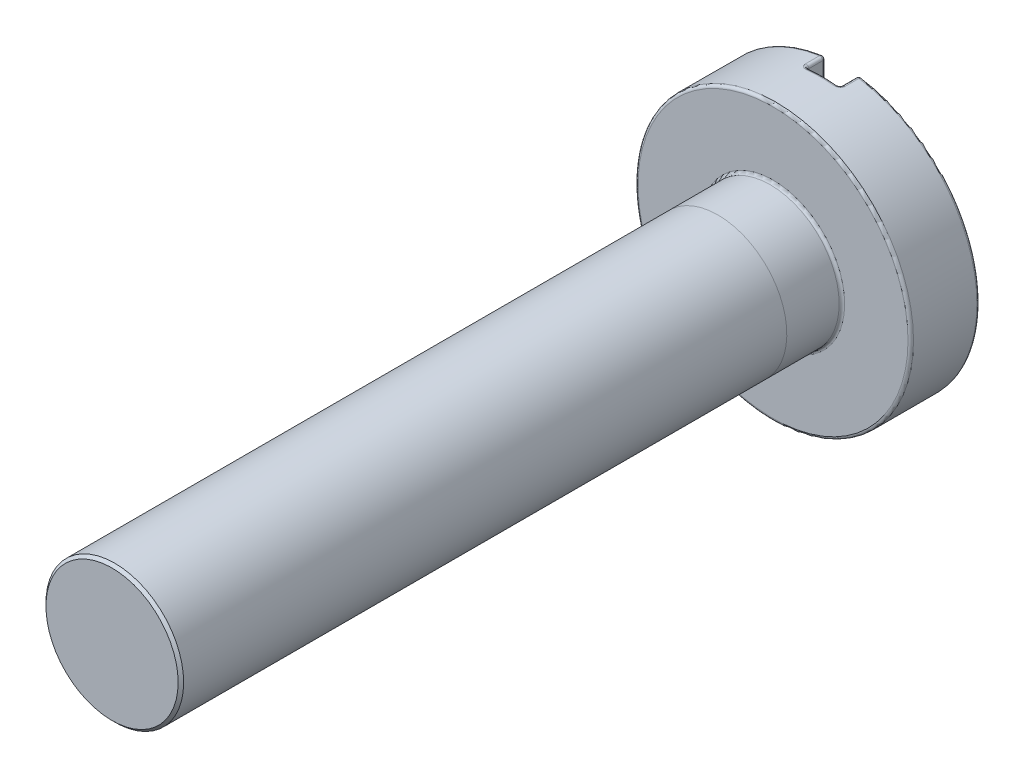
from build123d import *

# Parameters (mm, degrees)
SKETCH1_R           = 1.25
BOSS_EXTRUDE1_DEPTH = 12
SKETCH2_R           = 2.5
BOSS_EXTRUDE2_DEPTH = 1.25
SKETCH3_W           = 0.6
SKETCH3_H           = 8.393754192
CUT_EXTRUDE1_DEPTH  = 0.35
FILLET1_R           = 0.05
FILLET2_R           = 0.05
CHAMFER1_SIZE       = 0.05


with BuildPart() as part:
    # Sketch1 → Boss-Extrude1 (new body)
    with BuildSketch(Plane.XY):
        Circle(SKETCH1_R)
    extrude(amount=BOSS_EXTRUDE1_DEPTH)

    # Sketch2 → Boss-Extrude2 (add)
    with BuildSketch(Plane.XY):
        Circle(SKETCH2_R)
    extrude(amount=-BOSS_EXTRUDE2_DEPTH)

    # Sketch3 → Cut-Extrude1 (cut)
    with BuildSketch(Plane(origin=(0, 0, -1.25), x_dir=(-1, 0, 0), z_dir=(0, 0, -1))):
        Rectangle(SKETCH3_W, SKETCH3_H)
    extrude(amount=-CUT_EXTRUDE1_DEPTH, mode=Mode.SUBTRACT)

    # Fillet1
    fillet1_edges = [part.edges().sort_by_distance(p)[0] for p in [
        (-2.5, 0, -1.25),
        (1.870828693, -1.658312395, -1.25),
        (0.3, 0, -1.25),
        (-0.3, 0, -1.25),
        (0, 2.5, -0.9),
        (0, -2.5, -0.9),
        (-0.3, -2.481934729, -1.075),
        (-0.3, 2.481934729, -1.075),
        (0.3, 2.481934729, -1.075),
        (0.3, -2.481934729, -1.075),
        (-0.3, 0, -0.9),
        (0.3, 0, -0.9),
        (-1.25, 0, 0),
    ]]
    fillet(fillet1_edges, radius=FILLET1_R)

    # Fillet2
    fillet2_edges = [part.edges().sort_by_distance(p)[0] for p in [
        (-2.5, 0, 0),
    ]]
    fillet(fillet2_edges, radius=FILLET2_R)

    # Chamfer1
    chamfer1_edges = [part.edges().sort_by_distance(p)[0] for p in [
        (-1.25, 0, 12),
    ]]
    chamfer(chamfer1_edges, length=CHAMFER1_SIZE)


solid = part.part
